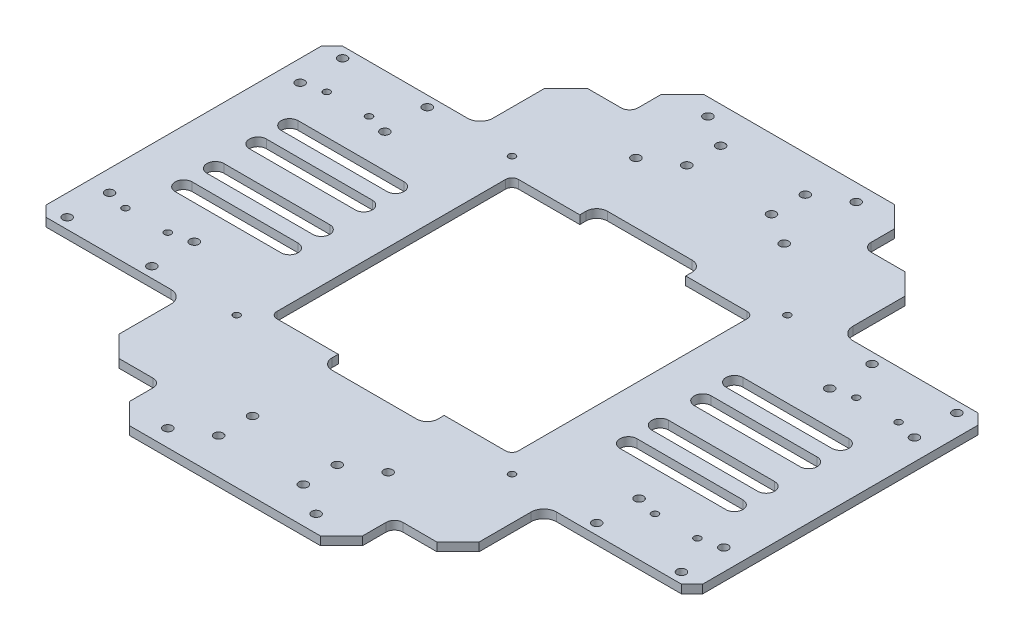
from build123d import *

# Parameters (mm, degrees)
SKETCH_1_W          = 110
SKETCH_1_H          = 270.99984649
SKETCH_1_R          = 2.1
EXTRUDE_1_DEPTH     = 4
CHAMFER_1_SIZE      = 10
CUT_EXTRUDE_1_DEPTH = 4
FILLET_1_R          = 5
EXTRUDE_2_DEPTH     = 4
CHAMFER_2_SIZE      = 10
FILLET_2_R          = 4
FILLET_3_R          = 5
SKETCH_5_R          = 1.6
CUT_EXTRUDE_2_DEPTH = 4
SKETCH_7_W          = 70
SKETCH_7_H          = 140
EXTRUDE_3_DEPTH     = 4
FILLET_4_R          = 6
SKETCH_8_R          = 2.1
CUT_EXTRUDE_3_DEPTH = 4
SKETCH_9_R          = 1.6
CUT_EXTRUDE_4_DEPTH = 4
CHAMFER_3_SIZE      = 5
SKETCH_11_W         = 114
SKETCH_11_H         = 114.028365308
CUT_EXTRUDE_5_DEPTH = 10
FILLET_5_R          = 3


with BuildPart() as part:
    # 草图1 → 凸台-拉伸1 (new body)
    with BuildSketch(Plane(origin=(0, 0, 0), x_dir=(1, 0, 0), z_dir=(0, 1, 0))):
        Rectangle(SKETCH_1_W, SKETCH_1_H)
        with Locations(Location((-35, 127.499923245, 0), (0, 0, 270))):
            Circle(SKETCH_1_R, mode=Mode.SUBTRACT)
        with Locations(Location((-20, 118.499923245, 0), (0, 0, 270))):
            Circle(SKETCH_1_R, mode=Mode.SUBTRACT)
        with Locations(Location((20, 118.499923245, 0), (0, 0, 270))):
            Circle(SKETCH_1_R, mode=Mode.SUBTRACT)
        with Locations(Location((35, 127.499923245, 0), (0, 0, 270))):
            Circle(SKETCH_1_R, mode=Mode.SUBTRACT)
        with Locations(Location((20, 102.499923245, 0), (0, 0, 270))):
            Circle(SKETCH_1_R, mode=Mode.SUBTRACT)
        with Locations(Location((35, 93.499923245, 0), (0, 0, 270))):
            Circle(SKETCH_1_R, mode=Mode.SUBTRACT)
        with Locations(Location((-35, 93.499923245, 0), (0, 0, 270))):
            Circle(SKETCH_1_R, mode=Mode.SUBTRACT)
        with Locations(Location((-20, 102.499923245, 0), (0, 0, 270))):
            Circle(SKETCH_1_R, mode=Mode.SUBTRACT)
        with Locations(Location((-35, -127.499923245, 0), (0, 0, 270))):
            Circle(SKETCH_1_R, mode=Mode.SUBTRACT)
        with Locations(Location((-20, -118.499923245, 0), (0, 0, 270))):
            Circle(SKETCH_1_R, mode=Mode.SUBTRACT)
        with Locations(Location((-20, -102.499923245, 0), (0, 0, 270))):
            Circle(SKETCH_1_R, mode=Mode.SUBTRACT)
        with Locations(Location((20, -118.499923245, 0), (0, 0, 270))):
            Circle(SKETCH_1_R, mode=Mode.SUBTRACT)
        with Locations(Location((20, -102.499923245, 0), (0, 0, 270))):
            Circle(SKETCH_1_R, mode=Mode.SUBTRACT)
        with Locations(Location((35, -93.499923245, 0), (0, 0, 270))):
            Circle(SKETCH_1_R, mode=Mode.SUBTRACT)
        with Locations(Location((35, -127.499923245, 0), (0, 0, 270))):
            Circle(SKETCH_1_R, mode=Mode.SUBTRACT)
    extrude(amount=EXTRUDE_1_DEPTH)

    # 倒角1
    chamfer_1_edges = [part.edges().sort_by_distance(p)[0] for p in [
        (55, 2, -135.499923245),
        (55, 2, 135.499923245),
        (-55, 2, 135.499923245),
        (-55, 2, -135.499923245),
    ]]
    chamfer(chamfer_1_edges, length=CHAMFER_1_SIZE)

    # 草图2 → 切除-拉伸1 (cut)
    with BuildSketch(Plane(origin=(0, 4, 0), x_dir=(1, 0, 0), z_dir=(0, 1, 0))):
        Polygon((-25, 45), (-40, 30), (-40, -30), (-25, -45), (-25, -65), (25, -65), (25, -45), (40, -30), (40, 30), (25, 45), (25, 65), (-25, 65), align=None)
    extrude(amount=-CUT_EXTRUDE_1_DEPTH, mode=Mode.SUBTRACT)

    # 圆角1
    fillet_1_edges = [part.edges().sort_by_distance(p)[0] for p in [
        (25, 2, -65),
        (25, 2, 65),
        (-25, 2, 65),
        (-25, 2, -65),
    ]]
    fillet(fillet_1_edges, radius=FILLET_1_R)

    # 草图3 → 凸台-拉伸2 (add)
    with BuildSketch(Plane(origin=(0, 4, 0), x_dir=(1, 0, 0), z_dir=(0, 1, 0))):
        Polygon((55, 110.499923245), (85, 110.499923245), (85, 93.499923245), (85, -102.499923245), (85, -110.499923245), (55, -110.499923245), (55, -102.499923245), (55, 93.499923245), align=None)
        Polygon((-85, 93.499923245), (-85, -102.499923245), (-85, -110.499923245), (-55, -110.499923245), (-55, -102.499923245), (-55, 93.499923245), (-55, 110.499923245), (-85, 110.499923245), align=None)
    extrude(amount=-EXTRUDE_2_DEPTH)

    # 倒角2
    chamfer_2_edges = [part.edges().sort_by_distance(p)[0] for p in [
        (-85, 2, -110.499923245),
        (-85, 2, 110.499923245),
        (85, 2, 110.499923245),
        (85, 2, -110.499923245),
    ]]
    chamfer(chamfer_2_edges, length=CHAMFER_2_SIZE)

    # 圆角2
    fillet_2_edges = [part.edges().sort_by_distance(p)[0] for p in [
        (-55, 2, -110.499923245),
        (55, 2, -110.499923245),
        (55, 2, 110.499923245),
        (-55, 2, 110.499923245),
    ]]
    fillet(fillet_2_edges, radius=FILLET_2_R)

    # 圆角3
    fillet_3_edges = [part.edges().sort_by_distance(p)[0] for p in [
        (40, 2, -30),
        (40, 2, 30),
        (-40, 2, 30),
        (-40, 2, -30),
    ]]
    fillet(fillet_3_edges, radius=FILLET_3_R)

    # 草图5 → 切除-拉伸2 (cut)
    with BuildSketch(Plane(origin=(0, 4, 0), x_dir=(1, 0, 0), z_dir=(0, 1, 0))):
        with Locations(Location((-65, 65, 0), (0, 0, 270))):
            Circle(SKETCH_5_R)
        with Locations(Location((65, 65, 0), (0, 0, 270))):
            Circle(SKETCH_5_R)
        with Locations(Location((65, -65, 0), (0, 0, 270))):
            Circle(SKETCH_5_R)
        with Locations(Location((-65, -65, 0), (0, 0, 270))):
            Circle(SKETCH_5_R)
    extrude(amount=-CUT_EXTRUDE_2_DEPTH, mode=Mode.SUBTRACT)

    # 草图7 → 凸台-拉伸3 (add)
    with BuildSketch(Plane(origin=(0, 4, 0), x_dir=(1, 0, 0), z_dir=(0, 1, 0))):
        Polygon((-85, 0), (-85, 70), (-155, 70), (-155, -70), (-85, -70), align=None)
        with Locations((120, 0)):
            Rectangle(SKETCH_7_W, SKETCH_7_H)
    extrude(amount=-EXTRUDE_3_DEPTH)

    # 圆角4
    fillet_4_edges = [part.edges().sort_by_distance(p)[0] for p in [
        (-85, 2, 70),
        (-85, 2, -70),
        (85, 2, 70),
        (85, 2, -70),
    ]]
    fillet(fillet_4_edges, radius=FILLET_4_R)

    # 草图8 → 切除-拉伸3 (cut)
    with BuildSketch(Plane(origin=(0, 4, 0), x_dir=(1, 0, 0), z_dir=(0, 1, 0))):
        with Locations(Location((105, 65, 0), (0, 0, 270))):
            Circle(SKETCH_8_R)
        with Locations(Location((145, 65, 0), (0, 0, 270))):
            Circle(SKETCH_8_R)
        with Locations(Location((145, 45, 0), (0, 0, 270))):
            Circle(SKETCH_8_R)
        with Locations(Location((105, 45, 0), (0, 0, 270))):
            Circle(SKETCH_8_R)
        with Locations(Location((145, -45, 0), (0, 0, 270))):
            Circle(SKETCH_8_R)
        with Locations(Location((145, -65, 0), (0, 0, 270))):
            Circle(SKETCH_8_R)
        with Locations(Location((105, -65, 0), (0, 0, 270))):
            Circle(SKETCH_8_R)
        with Locations(Location((105, -45, 0), (0, 0, 270))):
            Circle(SKETCH_8_R)
        with Locations(Location((-145, 65, 0), (0, 0, 270))):
            Circle(SKETCH_8_R)
        with Locations(Location((-105, 65, 0), (0, 0, 270))):
            Circle(SKETCH_8_R)
        with Locations(Location((-105, 45, 0), (0, 0, 270))):
            Circle(SKETCH_8_R)
        with Locations(Location((-145, 45, 0), (0, 0, 270))):
            Circle(SKETCH_8_R)
        with Locations(Location((-145, -45, 0), (0, 0, 270))):
            Circle(SKETCH_8_R)
        with Locations(Location((-105, -45, 0), (0, 0, 270))):
            Circle(SKETCH_8_R)
        with Locations(Location((-105, -65, 0), (0, 0, 270))):
            Circle(SKETCH_8_R)
        with Locations(Location((-145, -65, 0), (0, 0, 270))):
            Circle(SKETCH_8_R)
    extrude(amount=-CUT_EXTRUDE_3_DEPTH, mode=Mode.SUBTRACT)

    # 草图9 → 切除-拉伸4 (cut)
    with BuildSketch(Plane(origin=(0, 4, 0), x_dir=(1, 0, 0), z_dir=(0, 1, 0))):
        with Locations(Location((-135, 47.5, 0), (0, 0, 270))):
            Circle(SKETCH_9_R)
        with Locations(Location((-115, 47.5, 0), (0, 0, 90))):
            Circle(SKETCH_9_R)
        with Locations(Location((-115, -47.5, 0), (0, 0, 270))):
            Circle(SKETCH_9_R)
        with Locations(Location((-135, -47.5, 0), (0, 0, 90))):
            Circle(SKETCH_9_R)
        with Locations(Location((135, -47.5, 0), (0, 0, 270))):
            Circle(SKETCH_9_R)
        with Locations(Location((115, -47.5, 0), (0, 0, 90))):
            Circle(SKETCH_9_R)
        with Locations(Location((115, 47.5, 0), (0, 0, 270))):
            Circle(SKETCH_9_R)
        with Locations(Location((135, 47.5, 0), (0, 0, 90))):
            Circle(SKETCH_9_R)
        with BuildLine():
            Line((-130, 29.028690408), (-80, 29.028690408))
            ThreePointArc((-80, 29.028690408), (-76, 25.028690408), (-80, 21.028690408))
            Line((-80, 21.028690408), (-130, 21.028690408))
            ThreePointArc((-130, 21.028690408), (-134, 25.028690408), (-130, 29.028690408))
        make_face()
        with BuildLine():
            Line((-130, 14.028690408), (-80, 14.028690408))
            ThreePointArc((-80, 14.028690408), (-76, 10.028690408), (-80, 6.028690408))
            Line((-80, 6.028690408), (-130, 6.028690408))
            ThreePointArc((-130, 6.028690408), (-134, 10.028690408), (-130, 14.028690408))
        make_face()
        with BuildLine():
            Line((-130, -29.028690408), (-80, -29.028690408))
            ThreePointArc((-80, -29.028690408), (-76, -25.028690408), (-80, -21.028690408))
            Line((-80, -21.028690408), (-130, -21.028690408))
            ThreePointArc((-130, -21.028690408), (-134, -25.028690408), (-130, -29.028690408))
        make_face()
        with BuildLine():
            Line((-130, -14.028690408), (-80, -14.028690408))
            ThreePointArc((-80, -14.028690408), (-76, -10.028690408), (-80, -6.028690408))
            Line((-80, -6.028690408), (-130, -6.028690408))
            ThreePointArc((-130, -6.028690408), (-134, -10.028690408), (-130, -14.028690408))
        make_face()
        with BuildLine():
            Line((130, 29.028690408), (80, 29.028690408))
            ThreePointArc((80, 29.028690408), (76, 25.028690408), (80, 21.028690408))
            Line((80, 21.028690408), (130, 21.028690408))
            ThreePointArc((130, 21.028690408), (134, 25.028690408), (130, 29.028690408))
        make_face()
        with BuildLine():
            Line((130, 14.028690408), (80, 14.028690408))
            ThreePointArc((80, 14.028690408), (76, 10.028690408), (80, 6.028690408))
            Line((80, 6.028690408), (130, 6.028690408))
            ThreePointArc((130, 6.028690408), (134, 10.028690408), (130, 14.028690408))
        make_face()
        with BuildLine():
            Line((130, -29.028690408), (80, -29.028690408))
            ThreePointArc((80, -29.028690408), (76, -25.028690408), (80, -21.028690408))
            Line((80, -21.028690408), (130, -21.028690408))
            ThreePointArc((130, -21.028690408), (134, -25.028690408), (130, -29.028690408))
        make_face()
        with BuildLine():
            Line((130, -14.028690408), (80, -14.028690408))
            ThreePointArc((80, -14.028690408), (76, -10.028690408), (80, -6.028690408))
            Line((80, -6.028690408), (130, -6.028690408))
            ThreePointArc((130, -6.028690408), (134, -10.028690408), (130, -14.028690408))
        make_face()
    extrude(amount=-CUT_EXTRUDE_4_DEPTH, mode=Mode.SUBTRACT)

    # 倒角3
    chamfer_3_edges = [part.edges().sort_by_distance(p)[0] for p in [
        (155, 2, -70),
        (155, 2, 70),
        (-155, 2, 70),
        (-155, 2, -70),
    ]]
    chamfer(chamfer_3_edges, length=CHAMFER_3_SIZE)

    # 草图11 → 切除-拉伸5 (cut)
    with BuildSketch(Plane(origin=(0, 4, 0), x_dir=(1, 0, 0), z_dir=(0, 1, 0))):
        Rectangle(SKETCH_11_W, SKETCH_11_H)
    extrude(amount=-CUT_EXTRUDE_5_DEPTH, mode=Mode.SUBTRACT)

    # 圆角5
    fillet_5_edges = [part.edges().sort_by_distance(p)[0] for p in [
        (-57, 2, 57.014182654),
        (57, 2, -57.014182654),
        (57, 2, 57.014182654),
        (-57, 2, -57.014182654),
    ]]
    fillet(fillet_5_edges, radius=FILLET_5_R)


solid = part.part
